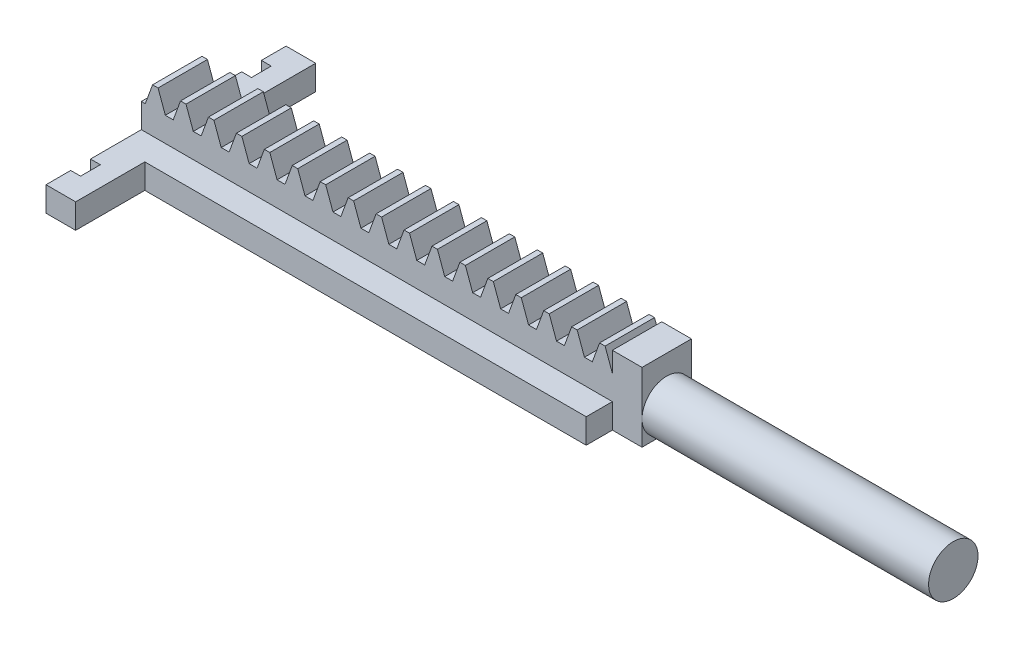
from build123d import *

# Parameters (mm, degrees)
BLANKSKE_W          = 47.667
BLANKSKE_H          = 7
BLANK_DEPTH         = 5
TOOTHCUTSIM_DEPTH   = 49.436999174
TEETHCUTS_COUNT     = 18
TEETHCUTS_PITCH     = 2.827433385
SKETCH1_R           = 2.5
BOSS_EXTRUDE1_DEPTH = 32
SKETCH2_W           = 2.647496805
SKETCH2_H           = 2.5
BOSS_EXTRUDE2_DEPTH = 47.667
SKETCH3_W           = 5
SKETCH3_H           = 7
BOSS_EXTRUDE3_DEPTH = 3
SKETCH4_W           = 3
SKETCH4_H           = 2.5
BOSS_EXTRUDE4_DEPTH = 7
SKETCH5_W           = 2
SKETCH5_H           = 2.5
CUT_EXTRUDE1_DEPTH  = 1


with BuildPart() as part:
    # BlankSke → Blank (new body)
    with BuildSketch(Plane.XY):
        with Locations((23.8335, 3.5)):
            Rectangle(BLANKSKE_W, BLANKSKE_H)
    extrude(amount=-BLANK_DEPTH)

    # TooCutSkeSim → ToothCutSim (cut, through all)
    with BuildSketch(Plane.XY):
        Polygon((0.399391833, 4.975), (-0.399391833, 4.975), (-1.145676401, 7.0254), (1.145676401, 7.0254), align=None)
    toothcutsim = extrude(amount=-TOOTHCUTSIM_DEPTH, mode=Mode.SUBTRACT)

    # TeethCuts: ToothCutSim ×18
    with Locations(*[(i * TEETHCUTS_PITCH, 0, 0) for i in range(1, TEETHCUTS_COUNT)]):
        add(toothcutsim, mode=Mode.SUBTRACT)

    # Sketch1 → Boss-Extrude1 (add)
    with BuildSketch(Plane(origin=(47.667, 0, 0), x_dir=(0, 0, -1), z_dir=(1, 0, 0))):
        with Locations((2.5, 2.4875)):
            Circle(SKETCH1_R)
    extrude(amount=BOSS_EXTRUDE1_DEPTH)

    # Sketch2 → Boss-Extrude2 (add)
    with BuildSketch(Plane.ZY):
        with Locations((-6.323748402, 1.25)):
            Rectangle(SKETCH2_W, SKETCH2_H)
        with Locations((1.323748403, 1.25)):
            Rectangle(SKETCH2_W, SKETCH2_H)
    extrude(amount=-BOSS_EXTRUDE2_DEPTH)

    # Sketch3 → Boss-Extrude3 (add)
    with BuildSketch(Plane(origin=(47.667, 0, 0), x_dir=(0, 0, -1), z_dir=(1, 0, 0))):
        with Locations((2.5, 3.5)):
            Rectangle(SKETCH3_W, SKETCH3_H)
    extrude(amount=BOSS_EXTRUDE3_DEPTH)

    # Sketch4 → Boss-Extrude4 (add)
    with BuildSketch(Plane(origin=(0, 0, -7.647496805), x_dir=(-1, 0, 0), z_dir=(0, 0, -1))):
        with Locations((-1.5, 1.25)):
            Rectangle(SKETCH4_W, SKETCH4_H)
    boss_extrude4 = extrude(amount=BOSS_EXTRUDE4_DEPTH)

    # Mirror1: Boss-Extrude4 across plane
    add(boss_extrude4.mirror(Plane(origin=(0, 0, -2.5), x_dir=(1, 0, 0), z_dir=(0, 0, -1))))

    # Sketch5 → Cut-Extrude1 (cut)
    with BuildSketch(Plane.ZY):
        with Locations((-11.147496805, 1.25)):
            Rectangle(SKETCH5_W, SKETCH5_H)
    cut_extrude1 = extrude(amount=-CUT_EXTRUDE1_DEPTH, mode=Mode.SUBTRACT)

    # Mirror2: Cut-Extrude1 across plane
    add(cut_extrude1.mirror(Plane(origin=(0, 0, -2.5), x_dir=(1, 0, 0), z_dir=(0, 0, -1))), mode=Mode.SUBTRACT)


solid = part.part
